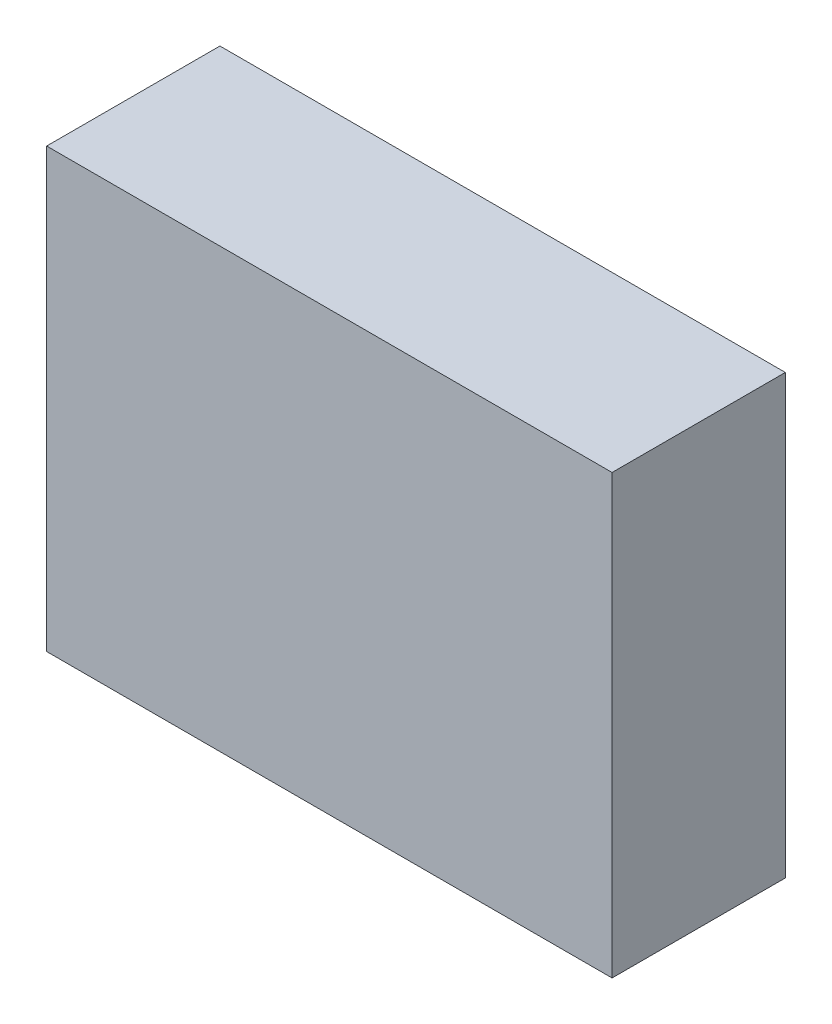
from build123d import *

# Parameters (mm, degrees)
SKETCH1_W               = 3.2635
SKETCH1_H               = 2.527
COMPONENT_OUTLINE_DEPTH = 1


with BuildPart() as part:
    # Sketch1 → Component_Outline (new body)
    with BuildSketch(Plane.XY):
        with Locations((-0.03175, 0)):
            Rectangle(SKETCH1_W, SKETCH1_H)
    extrude(amount=COMPONENT_OUTLINE_DEPTH)


solid = part.part
